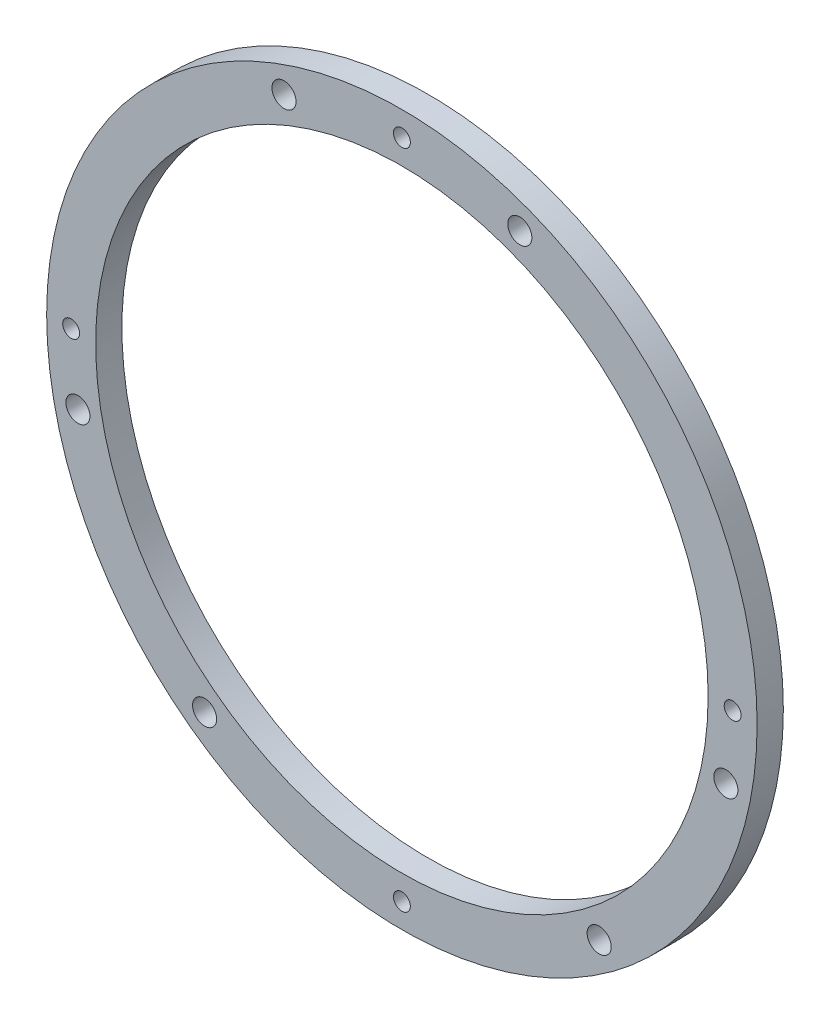
from build123d import *

# Parameters (mm, degrees)
SKETCH2_R           = 73.66
SKETCH2_R_2         = 63.5
SKETCH2_R_3         = 1.75
SKETCH2_R_4         = 2.5
BOSS_EXTRUDE1_DEPTH = 5.4356


with BuildPart() as part:
    # Sketch2 → Boss-Extrude1 (new body)
    with BuildSketch(Plane.XY.offset(-69.215)):
        Circle(SKETCH2_R)
        Circle(SKETCH2_R_2, mode=Mode.SUBTRACT)
        with Locations((-68.58, 0)):
            Circle(SKETCH2_R_3, mode=Mode.SUBTRACT)
        with Locations((0, 68.58)):
            Circle(SKETCH2_R_3, mode=Mode.SUBTRACT)
        with Locations((68.58, 0)):
            Circle(SKETCH2_R_3, mode=Mode.SUBTRACT)
        with Locations((0, -68.58)):
            Circle(SKETCH2_R_3, mode=Mode.SUBTRACT)
        with Locations((-24.449968278, 64.073515989)):
            Circle(SKETCH2_R_4, mode=Mode.SUBTRACT)
        with Locations((24.449968278, 64.073515989)):
            Circle(SKETCH2_R_4, mode=Mode.SUBTRACT)
        with Locations((-67.176013668, -13.80578095)):
            Circle(SKETCH2_R_4, mode=Mode.SUBTRACT)
        with Locations((-40.902096909, -55.047569142)):
            Circle(SKETCH2_R_4, mode=Mode.SUBTRACT)
        with Locations((40.902096909, -55.047569142)):
            Circle(SKETCH2_R_4, mode=Mode.SUBTRACT)
        with Locations((67.176013668, -13.80578095)):
            Circle(SKETCH2_R_4, mode=Mode.SUBTRACT)
    extrude(amount=BOSS_EXTRUDE1_DEPTH)


solid = part.part
